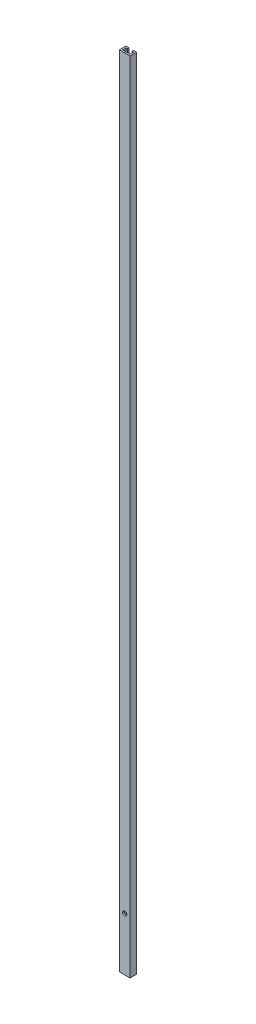
from build123d import *

# Parameters (mm, degrees)
EXTRUDE_1_DEPTH     = 600
SKETCH_2_R          = 1.6
CUT_EXTRUDE_1_DEPTH = 1.15


with BuildPart() as part:
    # 草图1 → 凸台-拉伸1 (new body)
    with BuildSketch(Plane(origin=(0, 0, 0), x_dir=(1, 0, 0), z_dir=(0, 1, 0))):
        Polygon((0, -5), (8, -5), (8, 0), (5.75, 0), (5.75, -1.15), (6.85, -1.15), (6.85, -3.85), (1.15, -3.85), (1.15, -1.15), (2.25, -1.15), (2.25, 0), (0, 0), align=None)
    extrude(amount=EXTRUDE_1_DEPTH)

    # 草图2 → 切除-拉伸1 (cut)
    with BuildSketch(Plane.XY.offset(5)):
        with Locations((4, 40)):
            Circle(SKETCH_2_R)
    extrude(amount=-CUT_EXTRUDE_1_DEPTH, mode=Mode.SUBTRACT)


solid = part.part
